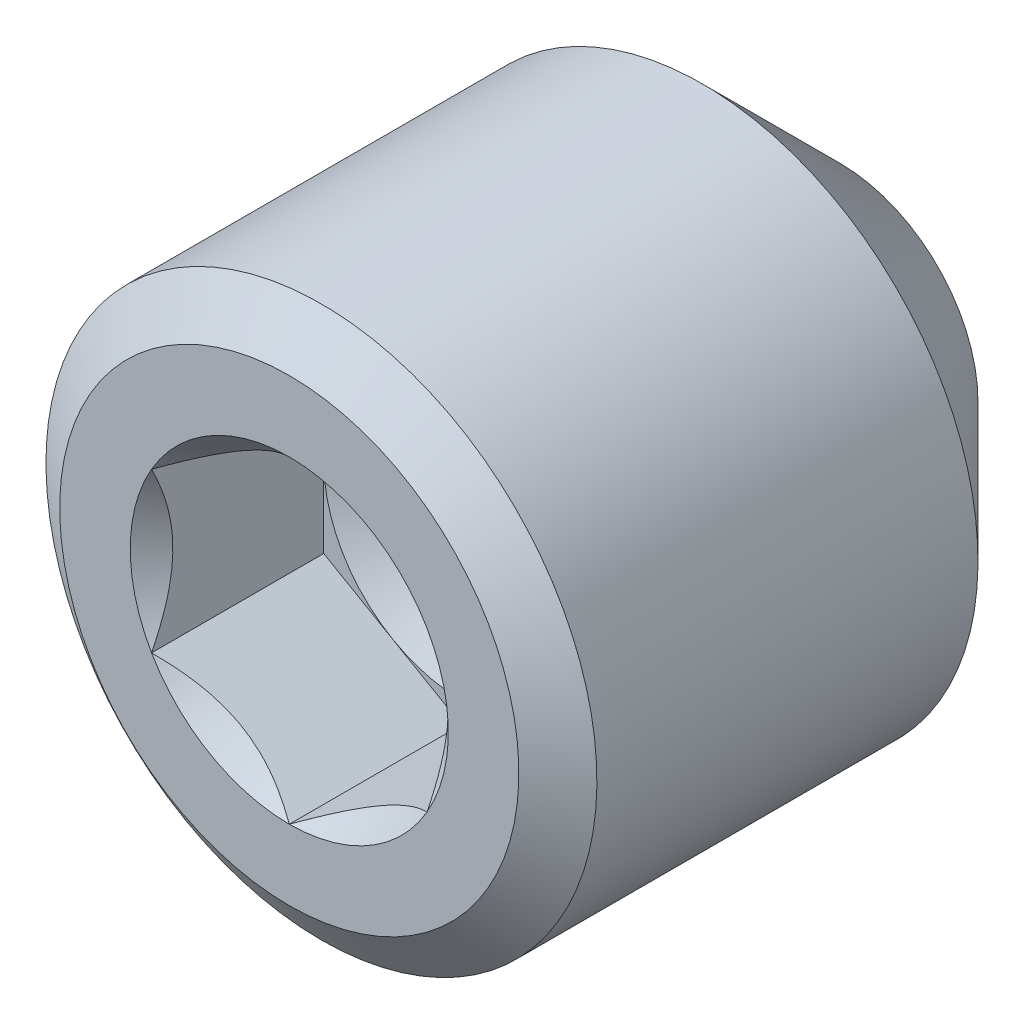
from build123d import *

# Parameters (mm, degrees)
CUT_EXTRUDE1_DEPTH = 0.9375


with BuildPart() as part:
    # Sketch11 → Revolve1 (revolve)
    with BuildSketch(Plane(origin=(0, 0, 0), x_dir=(0, 0, -1), z_dir=(1, 0, 0))):
        Polygon((-1.5, 0), (-1.5, 1.25), (-1.324948115, 1.5), (0.75, 1.5), (1.5, 0.75), (1.049354536, 0), align=None)
    revolve(axis=Axis((0, 0, -1.049354536), (0, 0, -1)))

    # Sketch2 → Cut-Extrude1 (cut)
    with BuildSketch(Plane.XY.offset(1.5)):
        Polygon((0, 0.866025404), (-0.75, 0.433012702), (-0.75, -0.433012702), (0, -0.866025404), (0.75, -0.433012702), (0.75, 0.433012702), align=None)
    extrude(amount=-CUT_EXTRUDE1_DEPTH, mode=Mode.SUBTRACT)

    # Cut-Extrude2 cone 1 section (through the dimple's axis) → Cut-Extrude2 (revolve, cut)
    with BuildSketch(Plane(origin=(0, 0, 1.5), x_dir=(0, -1, 0), z_dir=(1, 0, 0))):
        Polygon((0, 0), (0.866025404, 0), (0, 0.866025404), align=None)
    revolve(axis=Axis((0, 0, 1.5), (0, 0, -1)), mode=Mode.SUBTRACT)

    # Cut-Extrude3 cone 1 section (through the dimple's axis) → Cut-Extrude3 (revolve, cut)
    with BuildSketch(Plane(origin=(0, 0, 0.5625), x_dir=(0, -1, 0), z_dir=(1, 0, 0))):
        Polygon((0, 0), (0.75, 0), (0, 0.433012702), align=None)
    revolve(axis=Axis((0, 0, 0.5625), (0, 0, -1)), mode=Mode.SUBTRACT)


solid = part.part
